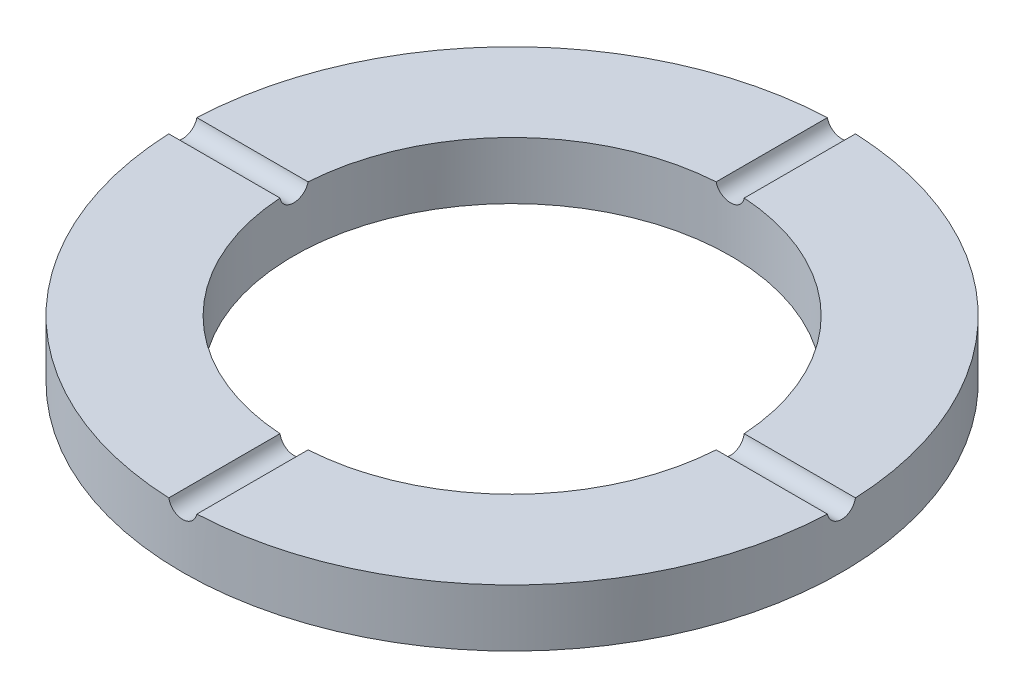
from build123d import *

# Parameters (mm, degrees)
SKETCH1_R               = 23
SKETCH1_R_2             = 15.25
BOSS_EXTRUDE1_DEPTH     = 4
CUT_EXTRUDE1_DEPTH      = 33.771939216
CUT_EXTRUDE1_DEPTH_BACK = 33.771939216
SKETCH2_R               = 1
CUT_EXTRUDE2_DEPTH      = 33.771939369
CUT_EXTRUDE2_DEPTH_BACK = 33.771939369
SKETCH4_R               = 1


with BuildPart() as part:
    # Sketch1 → Boss-Extrude1 (new body)
    with BuildSketch(Plane(origin=(0, 0, 0), x_dir=(1, 0, 0), z_dir=(0, 1, 0))):
        Circle(SKETCH1_R)
        Circle(SKETCH1_R_2, mode=Mode.SUBTRACT)
    extrude(amount=BOSS_EXTRUDE1_DEPTH)

    # Sketch2 → Cut-Extrude1 (cut, two sides: drawn at the far end of the back side and taken through both)
    with BuildSketch(Plane.XY.offset(-CUT_EXTRUDE1_DEPTH_BACK)):
        with Locations((0, 4.2)):
            Circle(SKETCH2_R)
    extrude(amount=CUT_EXTRUDE1_DEPTH + CUT_EXTRUDE1_DEPTH_BACK, mode=Mode.SUBTRACT)

    # Sketch4 → Cut-Extrude2 (cut, two sides: drawn at the far end of the back side and taken through both)
    with BuildSketch(Plane(origin=(0, 0, 0), x_dir=(0, 0, -1), z_dir=(1, 0, 0)).offset(-CUT_EXTRUDE2_DEPTH_BACK)):
        with Locations((0, 4.2)):
            Circle(SKETCH4_R)
    extrude(amount=CUT_EXTRUDE2_DEPTH + CUT_EXTRUDE2_DEPTH_BACK, mode=Mode.SUBTRACT)


solid = part.part
